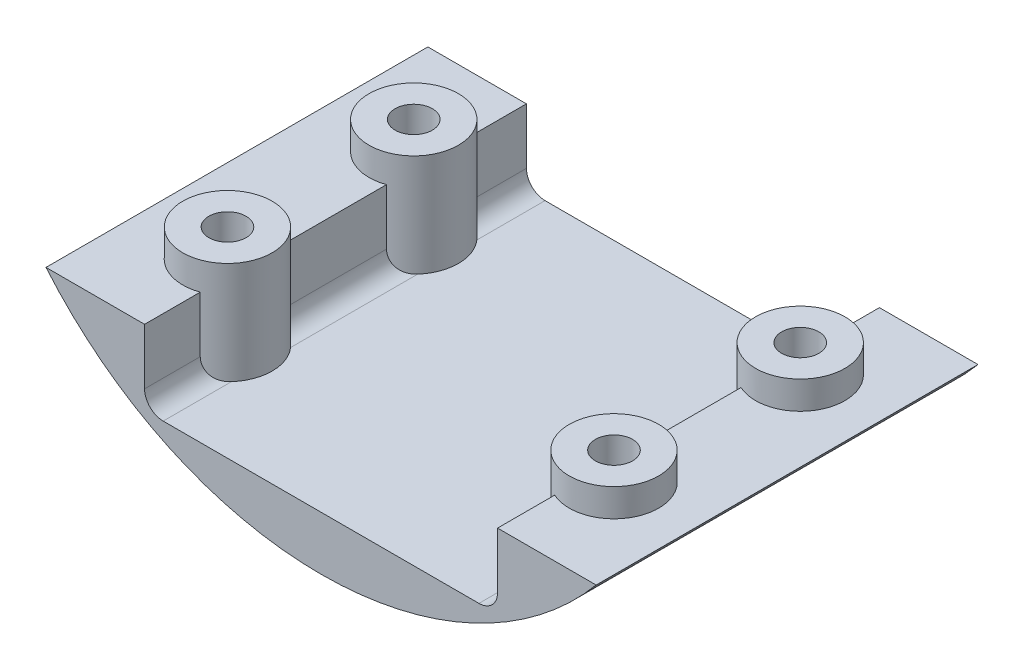
from build123d import *
from build123d.topology import SkipClean

# Parameters (mm, degrees)
BOSS_EXTRUDE1_DEPTH = 41
SKETCH3_R           = 4.8
SKETCH3_R_2         = 2
BOSS_EXTRUDE2_DEPTH = 3
CUT_EXTRUDE1_START  = -8
CUT_EXTRUDE1_DEPTH  = 8
FILLET1_R           = 2


with BuildPart() as part:
    # Sketch2 → Boss-Extrude1 (new body)
    with BuildSketch(Plane.XY):
        with BuildLine():
            Line((-29.533359675, -24.776665762), (29.533359675, -24.776665762))
            ThreePointArc((29.533359675, -24.776665762), (0, -38.55), (-29.533359675, -24.776665762))
        make_face()
    extrude(amount=-BOSS_EXTRUDE1_DEPTH)

    # Sketch3 → Boss-Extrude2 (add)
    # profile 1 of 4: a face of its own
    with BuildSketch(Plane(origin=(0, -24.776665762, 0), x_dir=(1, 0, 0), z_dir=(0, 1, 0))):
        with Locations(Location((20.95, 10.5, 0), (0, 0, 270))):
            Circle(SKETCH3_R)
        with Locations(Location((20.95, 10.5, 0), (0, 0, 270))):
            Circle(SKETCH3_R_2, mode=Mode.SUBTRACT)
    # profile 2 of 4: a face of its own
    with BuildSketch(Plane(origin=(0, -24.776665762, 0), x_dir=(1, 0, 0), z_dir=(0, 1, 0))):
        with Locations(Location((20.95, 30.5, 0), (0, 0, 270))):
            Circle(SKETCH3_R)
        with Locations(Location((20.95, 30.5, 0), (0, 0, 270))):
            Circle(SKETCH3_R_2, mode=Mode.SUBTRACT)
    # profile 3 of 4: a face of its own
    with BuildSketch(Plane(origin=(0, -24.776665762, 0), x_dir=(1, 0, 0), z_dir=(0, 1, 0))):
        with Locations(Location((-20.55, 30.5, 0), (0, 0, 270))):
            Circle(SKETCH3_R)
        with Locations(Location((-20.55, 30.5, 0), (0, 0, 270))):
            Circle(SKETCH3_R_2, mode=Mode.SUBTRACT)
    # profile 4 of 4: a face of its own
    with BuildSketch(Plane(origin=(0, -24.776665762, 0), x_dir=(1, 0, 0), z_dir=(0, 1, 0))):
        with Locations(Location((-20.55, 10.5, 0), (0, 0, 270))):
            Circle(SKETCH3_R)
        with Locations(Location((-20.55, 10.5, 0), (0, 0, 270))):
            Circle(SKETCH3_R_2, mode=Mode.SUBTRACT)
    extrude(amount=BOSS_EXTRUDE2_DEPTH)

    # Sketch4 → Cut-Extrude1 (cut)
    with SkipClean():  # the faces are left unmerged after this step: merging them gives an invalid solid
        with BuildSketch(Plane(origin=(0, -24.776665762, 0), x_dir=(1, 0, 0), z_dir=(0, 1, 0)).offset(CUT_EXTRUDE1_START)):
            with BuildLine():
                Line((-18.95, 5.9745166), (-18.95, 0))
                Line((-18.95, 0), (18.95, 0))
                Line((18.95, 0), (18.95, 6.136515154))
                ThreePointArc((18.95, 6.136515154), (16.15, 10.5), (18.95, 14.863484846))
                Line((18.95, 14.863484846), (18.95, 26.136515154))
                ThreePointArc((18.95, 26.136515154), (16.15, 30.5), (18.95, 34.863484846))
                Line((18.95, 34.863484846), (18.95, 41))
                Line((18.95, 41), (-18.95, 41))
                Line((-18.95, 41), (-18.95, 35.0254834))
                ThreePointArc((-18.95, 35.0254834), (-16.630816412, 33.271281292), (-15.75, 30.5))
                ThreePointArc((-15.75, 30.5), (-16.630816412, 27.728718708), (-18.95, 25.9745166))
                Line((-18.95, 25.9745166), (-18.95, 15.0254834))
                ThreePointArc((-18.95, 15.0254834), (-16.630816412, 13.271281292), (-15.75, 10.5))
                ThreePointArc((-15.75, 10.5), (-16.630816412, 7.728718708), (-18.95, 5.9745166))
            make_face()
        extrude(amount=CUT_EXTRUDE1_DEPTH, mode=Mode.SUBTRACT)

    # Fillet1
    fillet1_edges = [part.edges().sort_by_distance(p)[0] for p in [
        (18.95, -32.776665762, -37.931742423),
        (18.95, -32.776665762, -20.5),
        (18.95, -32.776665762, -3.068257577),
        (-18.95, -32.776665762, -2.9872583),
        (-18.95, -32.776665762, -20.5),
        (-18.95, -32.776665762, -38.0127417),
    ]]
    fillet(fillet1_edges, radius=FILLET1_R)


solid = part.part
